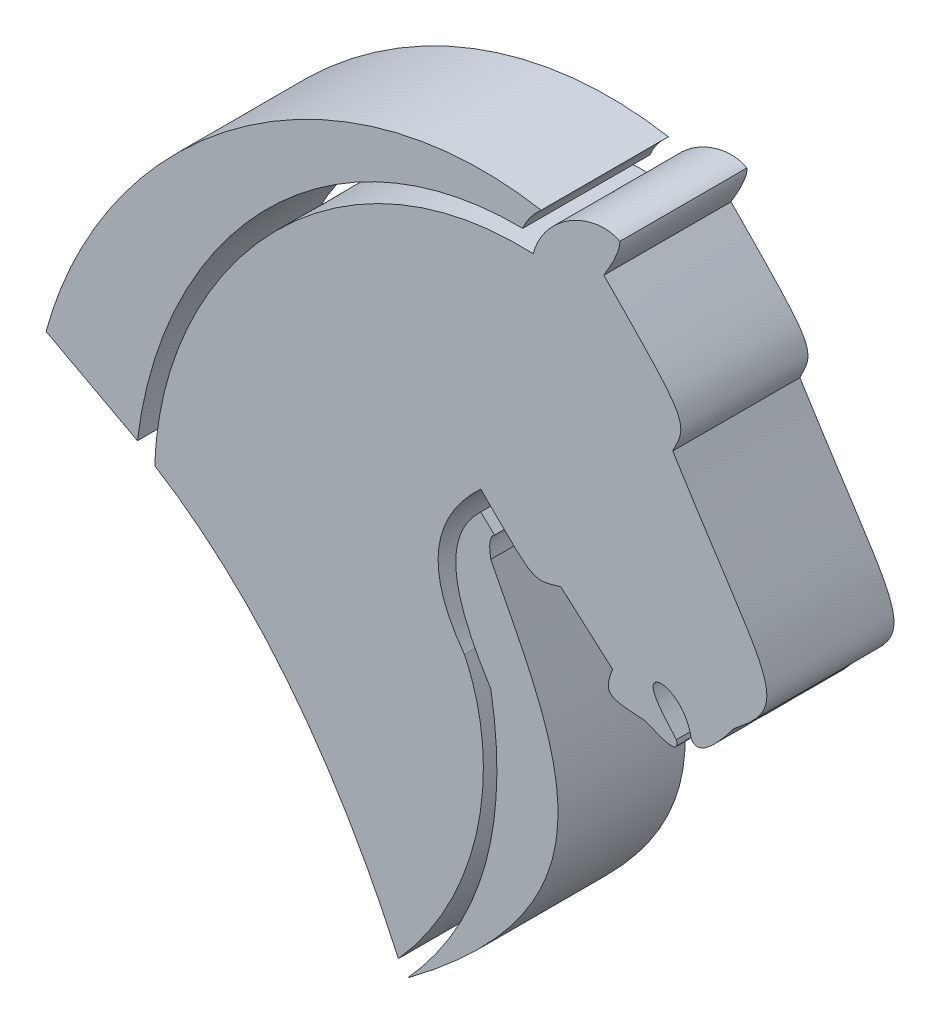
from build123d import *

# Parameters (mm, degrees)
BOSS_EXTRUDE6_START   = -75
BOSS_EXTRUDE6_DEPTH   = 10
BOSS_EXTRUDE6_2_DEPTH = 10
BOSS_EXTRUDE6_3_DEPTH = 10


with BuildPart() as part:
    # Sketch60 → Boss-Extrude6 (new body)
    with BuildSketch(Plane.XY.offset(BOSS_EXTRUDE6_START)):
        with BuildLine():
            add(Edge.make_bspline(
                [(7.899510272, 25.043165506), (-7.616062527, 25.257173407), (-20.549288392, 10.975590449), (-22.404008997, -4.575528469)],
                knots=[0, 0, 0, 0, 1, 1, 1, 1], degree=3))
            Line((-22.404008997, -4.575528469), (-29.594674586, -0.723386189))
            add(Edge.make_bspline(
                [(-29.594674586, -0.723386189), (-25.100511328, 15.755212423), (-7.658548516, 30.008093265), (9.354764023, 27.012038227)],
                knots=[0, 0, 0, 0, 1, 1, 1, 1], degree=3))
            add(Edge.make_bspline(
                [(9.354764023, 27.012038227), (8.337507713, 26.11755026), (7.899510272, 25.043165506)],
                knots=[0, 0, 0, 1, 1, 1], degree=2))
        make_face()
    extrude(amount=BOSS_EXTRUDE6_DEPTH)


with BuildPart() as body_2:
    # Sketch60 → Boss-Extrude6 2 (new body)
    with BuildSketch(Plane.XY.offset(BOSS_EXTRUDE6_START)):
        with BuildLine():
            add(Edge.make_bspline(
                [(-21.034358408, -5.60276641), (-20.658581062, 8.553464489), (-7.290986028, 24.477751373), (8.717335457, 23.728095995)],
                knots=[0, 0, 0, 0, 1, 1, 1, 1], degree=3))
            add(Edge.make_bspline(
                [(8.717335457, 23.728095995), (9.66306194, 27.172801895), (13.715689902, 29.012097365), (15.531023575, 27.971601235)],
                knots=[0, 0, 0, 0, 1, 1, 1, 1], degree=3))
            add(Edge.make_bspline(
                [(15.531023575, 27.971601235), (15.602666955, 27.212057166), (14.28241125, 25.043165506)],
                knots=[0, 0, 0, 1, 1, 1], degree=2))
            add(Edge.make_bspline(
                [(14.28241125, 25.043165506), (20.78562941, 18.394903927), (21.000842635, 18.24447546), (19.700260455, 15.777854084)],
                knots=[0, 0, 0, 0, 1, 1, 1, 1], degree=3))
            add(Edge.make_bspline(
                [(24.516635928, -0.723386189), (29.387839262, 3.066606953), (27.141695792, 3.679164482), (19.700260455, 15.777854084)],
                knots=[0, 0, 0, 0, 1, 1, 1, 1], degree=3))
            add(Edge.make_bspline(
                [(24.516635928, -0.723386189), (21.753412083, -4.397354565), (21.126152372, -3.017689185)],
                knots=[0, 0, 0, 1, 1, 1], degree=2))
            add(Edge.make_bspline(
                [(21.126152372, -3.017689185), (20.896285535, -1.389746942), (19.308339169, -0.179826073), (18.408429615, -0.610217599)],
                knots=[0, 0, 0, 0, 1, 1, 1, 1], degree=3))
            add(Edge.make_bspline(
                [(18.408429615, -0.610217599), (17.58666802, -1.079795653), (18.932824528, -2.56687226), (19.989391926, -3.740836035)],
                knots=[0, 0, 0, 0, 1, 1, 1, 1], degree=3))
            add(Edge.make_bspline(
                [(19.989391926, -3.740836035), (20.380619428, -4.992764042), (17.531856453, -3.678223666)],
                knots=[0, 0, 0, 1, 1, 1], degree=2))
            add(Edge.make_bspline(
                [(17.531856453, -3.678223666), (14.625120982, -3.53733032), (14.197274829, -3.40914492), (14.96429178, -1.453251695)],
                knots=[0, 0, 0, 0, 1, 1, 1, 1], degree=3))
            Line((14.96429178, -1.453251695), (10.896085132, 2.126595741))
            add(Edge.make_bspline(
                [(10.896085132, 2.126595741), (8.558808499, 1.4131365), (8.801315716, 1.477401795), (4.597691617, 5.628806961)],
                knots=[0, 0, 0, 0, 1, 1, 1, 1], degree=3))
            add(Edge.make_bspline(
                [(4.597691617, 5.628806961), (-1.389579693, 0.043058797), (3.310273965, -6.269124127)],
                knots=[0, 0, 0, 1, 1, 1], degree=2))
            add(Edge.make_bspline(
                [(3.310273965, -6.269124127), (6.190591422, -12.162929046), (5.143003854, -21.701416453), (-1.871341739, -29.587144351)],
                knots=[0, 0, 0, 0, 1, 1, 1, 1], degree=3))
            add(Edge.make_bspline(
                [(-21.034358408, -5.60276641), (-9.598924902, -12.672183887), (-1.871341739, -29.587144351)],
                knots=[0, 0, 0, 1, 1, 1], degree=2))
        make_face()
    extrude(amount=BOSS_EXTRUDE6_2_DEPTH)


with BuildPart() as body_3:
    # Sketch60 → Boss-Extrude6 3 (new body)
    with BuildSketch(Plane.XY.offset(BOSS_EXTRUDE6_START)):
        with BuildLine():
            add(Edge.make_bspline(
                [(4.597691617, 4.077756229), (1.575363437, 1.19846077), (2.21095693, -2.630747809), (5.384533612, -7.562523507)],
                knots=[0, 0, 0, 0, 1, 1, 1, 1], degree=3))
            add(Edge.make_bspline(
                [(5.384533612, -7.562523507), (7.711001047, -20.771808771), (-1.168779613, -30.555851486)],
                knots=[0, 0, 0, 1, 1, 1], degree=2))
            add(Edge.make_bspline(
                [(-1.168779613, -30.555851486), (16.280884402, -17.481086084), (10.776039321, -9.316518746), (5.384533612, 1.234606835)],
                knots=[0, 0, 0, 0, 1, 1, 1, 1], degree=3))
            add(Edge.make_bspline(
                [(5.384533612, 1.234606835), (5.124429062, 2.709937223), (5.687861943, 3.043823375)],
                knots=[0, 0, 0, 1, 1, 1], degree=2))
            Line((5.687861943, 3.043823375), (4.597691617, 4.077756229))
        make_face()
    extrude(amount=BOSS_EXTRUDE6_3_DEPTH)


solid = Compound([part.part, body_2.part, body_3.part])
